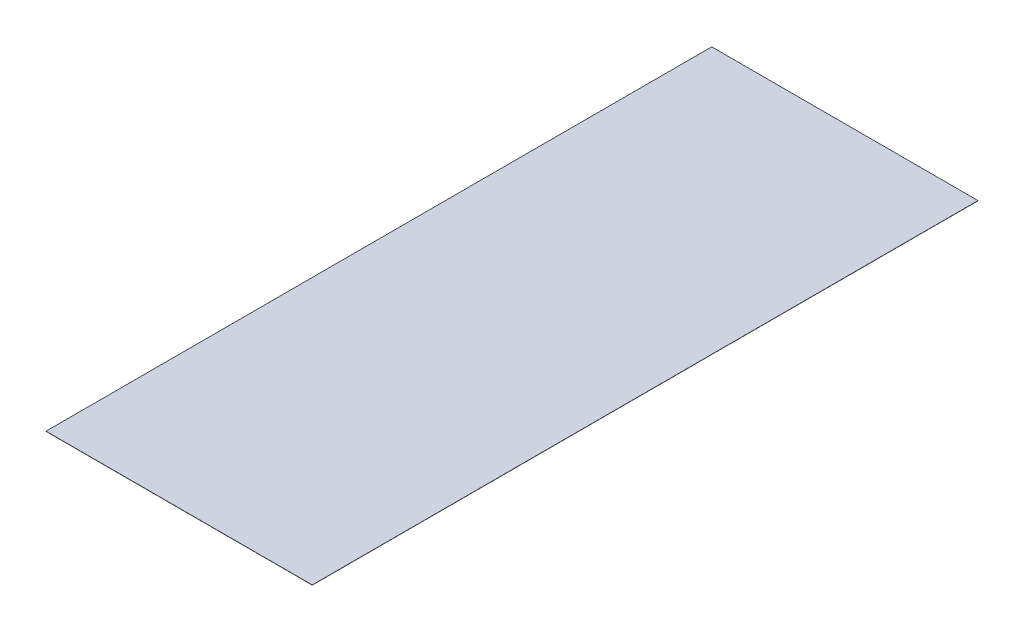
from build123d import *

# Parameters (mm, degrees)
SKETCH1_W           = 1219.2
SKETCH1_H           = 3048
BOSS_EXTRUDE1_DEPTH = 0.912


with BuildPart() as part:
    # Sketch1 → Boss-Extrude1 (new body)
    with BuildSketch(Plane(origin=(0, 0, 0), x_dir=(1, 0, 0), z_dir=(0, 1, 0))):
        Rectangle(SKETCH1_W, SKETCH1_H)
    extrude(amount=BOSS_EXTRUDE1_DEPTH)


solid = part.part
